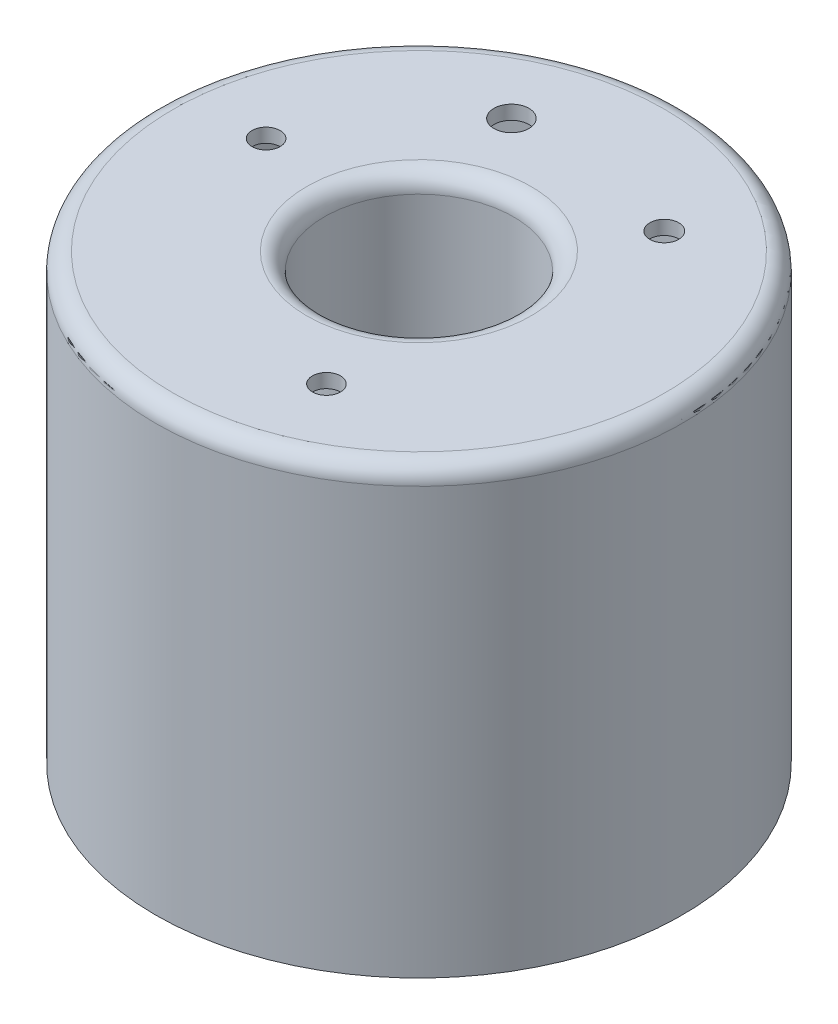
from build123d import *

# Parameters (mm, degrees)
SKETCH1_R           = 38.1635
SKETCH1_R_2         = 13.716
BOSS_EXTRUDE3_DEPTH = 64.262
SKETCH3_R           = 38.1
SKETCH3_R_2         = 14.097
CUT_EXTRUDE1_DEPTH  = 62.23
FILLET1_R           = 2.54
SKETCH5_R           = 2.093695025
SKETCH5_R_2         = 2.032
SKETCH5_R_3         = 2.54
CUT_EXTRUDE2_DEPTH  = 2.54


with BuildPart() as part:
    # Sketch1 → Boss-Extrude3 (new body)
    with BuildSketch(Plane(origin=(0, 0, 0), x_dir=(1, 0, 0), z_dir=(0, 1, 0))):
        with Locations(Location((0, 0, 0), (0, 0, 270))):
            Circle(SKETCH1_R)
        with Locations(Location((0, 0, 0), (0, 0, 270))):
            Circle(SKETCH1_R_2, mode=Mode.SUBTRACT)
    extrude(amount=BOSS_EXTRUDE3_DEPTH)

    # Sketch3 → Cut-Extrude1 (cut)
    with BuildSketch(Plane(origin=(0, 0, 0), x_dir=(-1, 0, 0), z_dir=(0, -1, 0))):
        with Locations(Location((0, 0, 0), (0, 0, 90))):
            Circle(SKETCH3_R)
        with Locations(Location((0, 0, 0), (0, 0, 90))):
            Circle(SKETCH3_R_2, mode=Mode.SUBTRACT)
    extrude(amount=-CUT_EXTRUDE1_DEPTH, mode=Mode.SUBTRACT)

    # Fillet1
    fillet1_edges = [part.edges().sort_by_distance(p)[0] for p in [
        (0, 64.262, -38.1635),
        (0, 64.262, -13.716),
    ]]
    fillet(fillet1_edges, radius=FILLET1_R)

    # Sketch5 → Cut-Extrude2 (cut)
    with BuildSketch(Plane(origin=(0, 64.262, 0), x_dir=(1, 0, 0), z_dir=(0, 1, 0))):
        with Locations(Location((15.256423447, 20.307672038, 0), (0, 0, 270))):
            Circle(SKETCH5_R)
        with Locations(Location((-25.2151716, 3.058614257, 0), (0, 0, 270))):
            Circle(SKETCH5_R_2)
        with Locations(Location((9.958748153, -23.366286295, 0), (0, 0, 270))):
            Circle(SKETCH5_R_2)
        with Locations(Location((-9.958748153, 23.366286295, 0), (0, 0, 270))):
            Circle(SKETCH5_R_3)
    extrude(amount=-CUT_EXTRUDE2_DEPTH, mode=Mode.SUBTRACT)


solid = part.part
